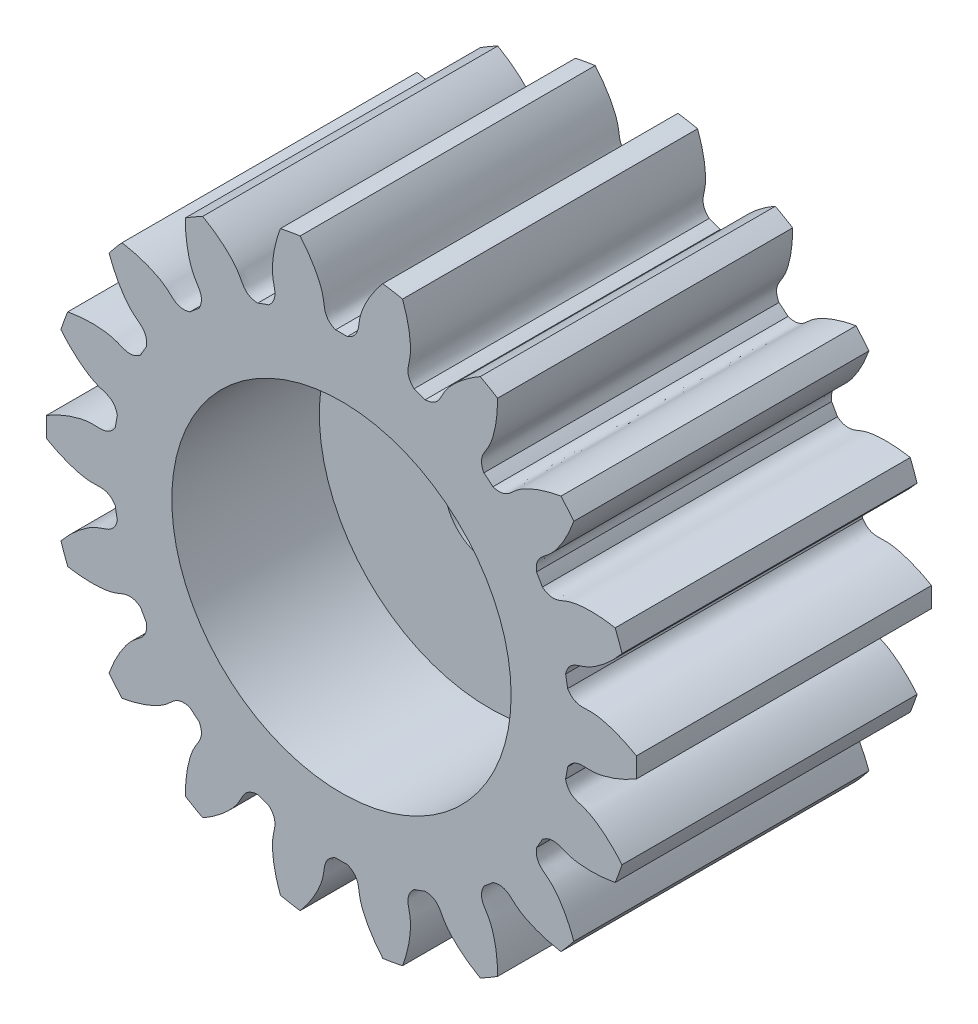
from build123d import *

# Parameters (mm, degrees)
SKETCH_1_R               = 10
EXTRUDE_1_DEPTH          = 10
CUT_EXTRUDE_1_DEPTH      = 18.320508076
PATTERN_CIRCULAR_1_COUNT = 18
SKETCH_4_R               = 5.75
CUT_EXTRUDE_2_DEPTH      = 5
SKETCH_5_R               = 1.5
CUT_EXTRUDE_3_DEPTH      = 5


with BuildPart() as part:
    # 草图1 → 凸台-拉伸1 (new body)
    with BuildSketch(Plane.XY):
        Circle(SKETCH_1_R)
    extrude(amount=EXTRUDE_1_DEPTH)

    # 草图2 → 切除-拉伸1 (cut, through all)
    with BuildSketch(Plane.XY):
        with BuildLine():
            ThreePointArc((0.199403559, 7.747434299), (0, 7.75), (-0.199403559, 7.747434299))
            add(Edge.make_bspline(
                [(-0.199403559, 7.747434299), (-0.61510404, 7.918680391), (-0.56278905, 8.238699502), (-0.631832915, 8.542595456), (-0.63875152, 8.570506601), (-0.647107593, 8.601540475), (-0.65702471, 8.635650183), (-0.668630031, 8.672784168), (-0.682047718, 8.712887332), (-0.697400853, 8.755900732), (-0.714810717, 8.801761729), (-0.734396875, 8.850403997), (-0.756277026, 8.901757578), (-0.780566921, 8.955748932), (-0.807380259, 9.01230098), (-0.836828597, 9.071333165), (-0.869021256, 9.132761504), (-0.904065225, 9.196498643), (-0.942065076, 9.262453924), (-0.98312287, 9.330533439), (-1.027338072, 9.400640102), (-1.074807462, 9.472673712), (-1.125625055, 9.54653102), (-1.179882014, 9.622105805), (-1.237666571, 9.699288945), (-1.299063947, 9.777968491), (-1.364156275, 9.858029744), (-1.433022524, 9.939355337), (-1.505738425, 10.021825314), (-1.582376404, 10.105317214), (-1.663005502, 10.189706153), (-1.747691321, 10.274864914), (-1.836495946, 10.360664035), (-1.929477891, 10.446971896), (-2.026692033, 10.533654813), (-2.128189554, 10.620577131), (-2.234017887, 10.707601317), (-2.34422066, 10.79458806), (-2.45883764, 10.881396363), (-2.577904698, 10.967883646), (-2.701453724, 11.053905845), (-2.874075353, 11.169039516), (-3.007555439, 11.252333779), (-3.098560891, 11.30667838)],
                knots=[0, 0, 0, 0, 0.187591972, 0.192996016, 0.1991206, 0.205965723, 0.213531386, 0.221817587, 0.230824328, 0.240551609, 0.250999428, 0.262167787, 0.274056685, 0.286666122, 0.299996099, 0.314046614, 0.32881767, 0.344309264, 0.360521397, 0.37745407, 0.395107283, 0.413481034, 0.432575325, 0.452390155, 0.472925524, 0.494181432, 0.51615788, 0.538854867, 0.562272393, 0.586410459, 0.611269064, 0.636848208, 0.663147891, 0.690168114, 0.717908876, 0.746370177, 0.775552017, 0.805454397, 0.836077316, 0.867420774, 0.899484772, 0.932269309, 1, 1, 1, 1], degree=3))
            ThreePointArc((-3.098560891, 11.30667838), (0, 11.723568381), (3.098560891, 11.30667838))
            add(Edge.make_bspline(
                [(0.199403559, 7.747434299), (0.61510404, 7.918680391), (0.56278905, 8.238699502), (0.631832915, 8.542595456), (0.63875152, 8.570506601), (0.647107593, 8.601540475), (0.65702471, 8.635650183), (0.668630031, 8.672784168), (0.682047718, 8.712887332), (0.697400853, 8.755900732), (0.714810717, 8.801761729), (0.734396875, 8.850403997), (0.756277026, 8.901757578), (0.780566921, 8.955748932), (0.807380259, 9.01230098), (0.836828597, 9.071333165), (0.869021256, 9.132761504), (0.904065225, 9.196498643), (0.942065076, 9.262453924), (0.98312287, 9.330533439), (1.027338072, 9.400640102), (1.074807462, 9.472673712), (1.125625055, 9.54653102), (1.179882014, 9.622105805), (1.237666571, 9.699288945), (1.299063947, 9.777968491), (1.364156275, 9.858029744), (1.433022524, 9.939355337), (1.505738425, 10.021825314), (1.582376404, 10.105317214), (1.663005502, 10.189706153), (1.747691321, 10.274864914), (1.836495946, 10.360664035), (1.929477891, 10.446971896), (2.026692033, 10.533654813), (2.128189554, 10.620577131), (2.234017887, 10.707601317), (2.34422066, 10.79458806), (2.45883764, 10.881396363), (2.577904698, 10.967883646), (2.701453724, 11.053905845), (2.874075353, 11.169039516), (3.007555439, 11.252333779), (3.098560891, 11.30667838)],
                knots=[0, 0, 0, 0, 0.187591972, 0.192996016, 0.1991206, 0.205965723, 0.213531386, 0.221817587, 0.230824328, 0.240551609, 0.250999428, 0.262167787, 0.274056685, 0.286666122, 0.299996099, 0.314046614, 0.32881767, 0.344309264, 0.360521397, 0.37745407, 0.395107283, 0.413481034, 0.432575325, 0.452390155, 0.472925524, 0.494181432, 0.51615788, 0.538854867, 0.562272393, 0.586410459, 0.611269064, 0.636848208, 0.663147891, 0.690168114, 0.717908876, 0.746370177, 0.775552017, 0.805454397, 0.836077316, 0.867420774, 0.899484772, 0.932269309, 1, 1, 1, 1], degree=3))
        make_face()
    cut_extrude_1 = extrude(amount=CUT_EXTRUDE_1_DEPTH, mode=Mode.SUBTRACT)

    # 阵列(圆周)1: 切除-拉伸1 ×18 about axis
    pattern_circular_1_axis = Axis((0, 0, -0.5), (0, 0, 1))
    for i in range(1, PATTERN_CIRCULAR_1_COUNT):
        add(cut_extrude_1.rotate(pattern_circular_1_axis, i * 360 / PATTERN_CIRCULAR_1_COUNT), mode=Mode.SUBTRACT)

    # 草图4 → 切除-拉伸2 (cut)
    with BuildSketch(Plane.XY.offset(10)):
        Circle(SKETCH_4_R)
    extrude(amount=-CUT_EXTRUDE_2_DEPTH, mode=Mode.SUBTRACT)

    # 草图5 → 切除-拉伸3 (cut)
    with BuildSketch(Plane.XY.offset(5)):
        Circle(SKETCH_5_R)
    extrude(amount=-CUT_EXTRUDE_3_DEPTH, mode=Mode.SUBTRACT)


solid = part.part
